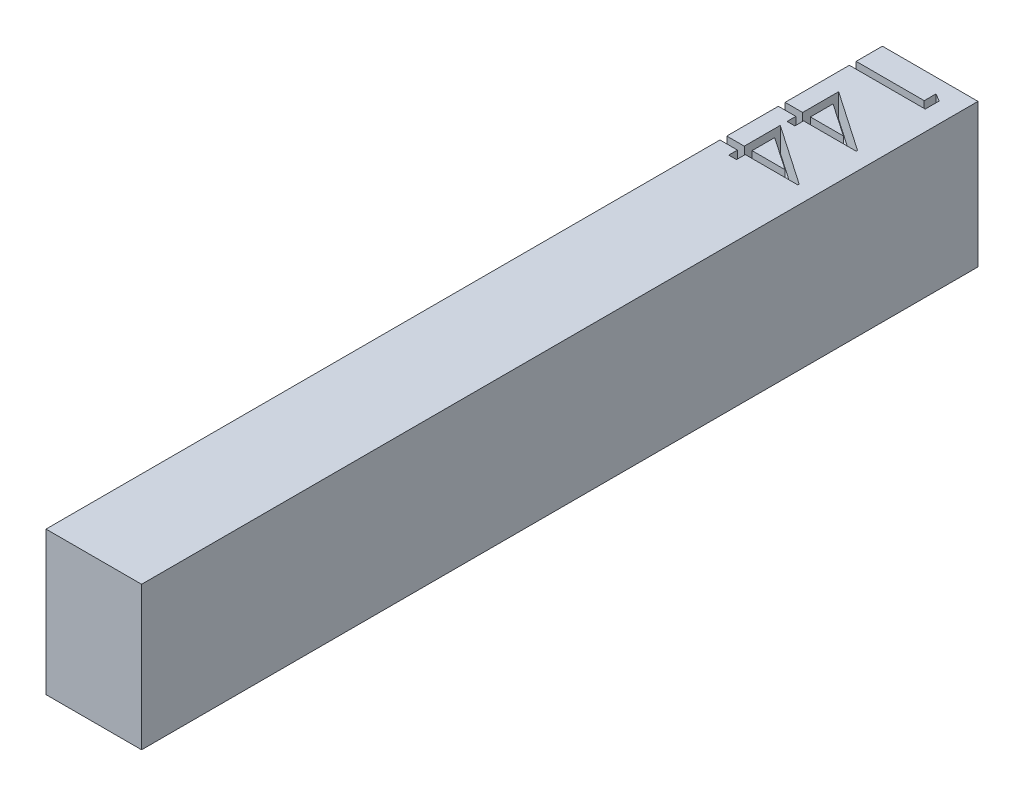
from build123d import *

# Parameters (mm, degrees)
SKETCH1_W           = 4
SKETCH1_H           = 35
BOSS_EXTRUDE1_DEPTH = 6
CUT_EXTRUDE1_DEPTH  = 1


with BuildPart() as part:
    # Sketch1 → Boss-Extrude1 (new body)
    with BuildSketch(Plane(origin=(0, 0, 0), x_dir=(1, 0, 0), z_dir=(0, 1, 0))):
        Rectangle(SKETCH1_W, SKETCH1_H)
    extrude(amount=BOSS_EXTRUDE1_DEPTH)

    # Sketch3 → Cut-Extrude1 (cut)
    # profile 1 of 3: a face of its own
    with BuildSketch(Plane(origin=(0, 6, 0), x_dir=(1, 0, 0), z_dir=(0, 1, 0))):
        Polygon((1.175, 16.703069912), (1.175, 16.116025641), (-2, 16.116025641), (-2, 16.400961538), (0.849358974, 16.400961538), (0.849358974, 16.889423077), align=None)
    # profile 2 of 3: a face of its own
    with BuildSketch(Plane(origin=(0, 6, 0), x_dir=(1, 0, 0), z_dir=(0, 1, 0))):
        Polygon((1.256410256, 13.202428886), (1.256410256, 13.144551282), (-0.941666667, 13.144551282), (-0.941666667, 12.778205128), (-1.267307692, 12.778205128), (-1.267307692, 13.144551282), (-2, 13.144551282), (-2, 13.429487179), (-1.267307692, 13.429487179), (-1.267307692, 14.935576923), align=None)
        Polygon((-0.941666667, 13.429487179), (0.437219551, 13.429487179), (-0.941666667, 14.37588141), align=None, mode=Mode.SUBTRACT)
    # profile 3 of 3: a face of its own
    with BuildSketch(Plane(origin=(0, 6, 0), x_dir=(1, 0, 0), z_dir=(0, 1, 0))):
        Polygon((1.256410256, 10.760121194), (1.256410256, 10.70224359), (-0.941666667, 10.70224359), (-0.941666667, 10.335897436), (-1.267307692, 10.335897436), (-1.267307692, 10.70224359), (-2, 10.70224359), (-2, 10.987179487), (-1.267307692, 10.987179487), (-1.267307692, 12.493269231), align=None)
        Polygon((-0.941666667, 10.987179487), (0.437219551, 10.987179487), (-0.941666667, 11.933573718), align=None, mode=Mode.SUBTRACT)
    extrude(amount=-CUT_EXTRUDE1_DEPTH, mode=Mode.SUBTRACT)


solid = part.part
